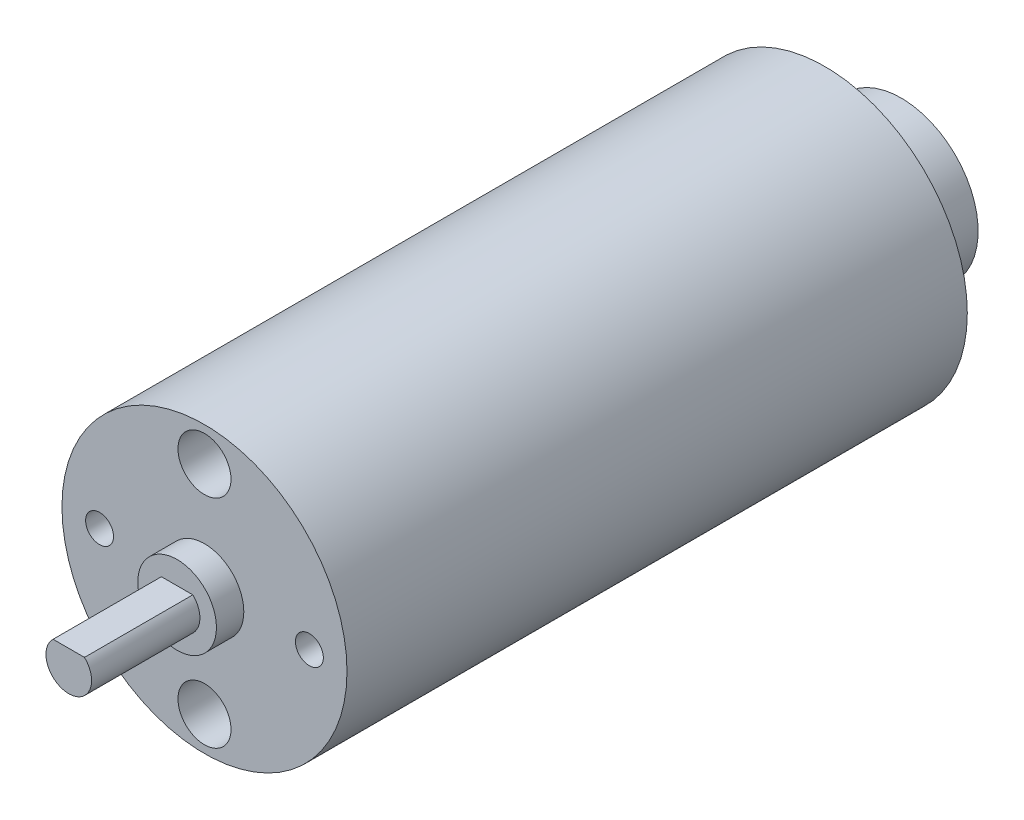
from build123d import *

# Parameters (mm, degrees)
SKETCH1_R           = 12.5
BOSS_EXTRUDE1_DEPTH = 54.4
SKETCH2_R           = 3.45
BOSS_EXTRUDE2_DEPTH = 2.4
SKETCH3_R           = 2
BOSS_EXTRUDE3_DEPTH = 9.5
SKETCH4_W           = 6.273306019
SKETCH4_H           = 2.779797978
CUT_EXTRUDE1_DEPTH  = 9.5
SKETCH5_R           = 2.325
CUT_EXTRUDE2_DEPTH  = 4.45
SKETCH6_R           = 1.225
CUT_EXTRUDE3_DEPTH  = 4.45
SKETCH8_R           = 1
BOSS_EXTRUDE5_DEPTH = 7.7
SKETCH9_R           = 6.75
BOSS_EXTRUDE6_DEPTH = 6.7
SKETCH10_R          = 6.75
CUT_EXTRUDE5_DEPTH  = 2.2
SKETCH11_R          = 1
BOSS_EXTRUDE7_DEPTH = 2.2


with BuildPart() as part:
    # Sketch1 → Boss-Extrude1 (new body)
    with BuildSketch(Plane.XY):
        Circle(SKETCH1_R)
    extrude(amount=BOSS_EXTRUDE1_DEPTH)

    # Sketch2 → Boss-Extrude2 (add)
    with BuildSketch(Plane.XY.offset(54.4)):
        Circle(SKETCH2_R)
    extrude(amount=BOSS_EXTRUDE2_DEPTH)

    # Sketch3 → Boss-Extrude3 (add)
    with BuildSketch(Plane.XY.offset(56.8)):
        Circle(SKETCH3_R)
    extrude(amount=BOSS_EXTRUDE3_DEPTH)

    # Sketch4 → Cut-Extrude1 (cut)
    with BuildSketch(Plane.XY.offset(66.3)):
        with Locations((-0.006157841, 2.839898989)):
            Rectangle(SKETCH4_W, SKETCH4_H)
    extrude(amount=-CUT_EXTRUDE1_DEPTH, mode=Mode.SUBTRACT)

    # Sketch5 → Cut-Extrude2 (cut)
    with BuildSketch(Plane.XY.offset(54.4)):
        with Locations((0, 9.5)):
            Circle(SKETCH5_R)
        with Locations((0, -9.5)):
            Circle(SKETCH5_R)
    extrude(amount=-CUT_EXTRUDE2_DEPTH, mode=Mode.SUBTRACT)

    # Sketch6 → Cut-Extrude3 (cut)
    with BuildSketch(Plane.XY.offset(54.4)):
        with Locations((9.2, 0)):
            Circle(SKETCH6_R)
        with Locations((-9.2, 0)):
            Circle(SKETCH6_R)
    extrude(amount=-CUT_EXTRUDE3_DEPTH, mode=Mode.SUBTRACT)

    # Sketch8 → Boss-Extrude5 (add)
    with BuildSketch(Plane(origin=(0, 0, 0), x_dir=(-1, 0, 0), z_dir=(0, 0, -1))):
        with Locations(Location((0, 0, 0), (0, 0, 180))):
            Circle(SKETCH8_R)
    extrude(amount=BOSS_EXTRUDE5_DEPTH)

    # Sketch9 → Boss-Extrude6 (add)
    with BuildSketch(Plane(origin=(0, 0, 0), x_dir=(-1, 0, 0), z_dir=(0, 0, -1))):
        with Locations(Location((0, 0, 0), (0, 0, 180))):
            Circle(SKETCH9_R)
    extrude(amount=BOSS_EXTRUDE6_DEPTH)

    # Sketch10 → Cut-Extrude5 (cut)
    with BuildSketch(Plane(origin=(0, 0, 0), x_dir=(-1, 0, 0), z_dir=(0, 0, -1))):
        Circle(SKETCH10_R)
    extrude(amount=CUT_EXTRUDE5_DEPTH, mode=Mode.SUBTRACT)


with BuildPart() as cut_extrude5_piece_1:
    # of the separate pieces the step leaves, piece 1, a body of its own (cut_extrude5_pieces)
    add(part.part.solids().sort_by_distance((12.5, 0, 0))[0])



with BuildPart() as cut_extrude5_piece_2:
    # of the separate pieces the step leaves, piece 2, a body of its own (cut_extrude5_pieces)
    add(part.part.solids().sort_by_distance((6.75, 0, -2.2))[0])


with BuildPart() as cut_extrude5_piece_1_1:
    add(cut_extrude5_piece_1.part)

    add(cut_extrude5_piece_2.part)  # Boss-Extrude7 merges Cut-Extrude5 piece 2
    # Sketch11 → Boss-Extrude7 (add)
    with BuildSketch(Plane(origin=(0, 0, 0), x_dir=(-1, 0, 0), z_dir=(0, 0, -1))):
        with Locations(Location((0, 0, 0), (0, 0, 180))):
            Circle(SKETCH11_R)
    extrude(amount=BOSS_EXTRUDE7_DEPTH)


solid = cut_extrude5_piece_1_1.part
